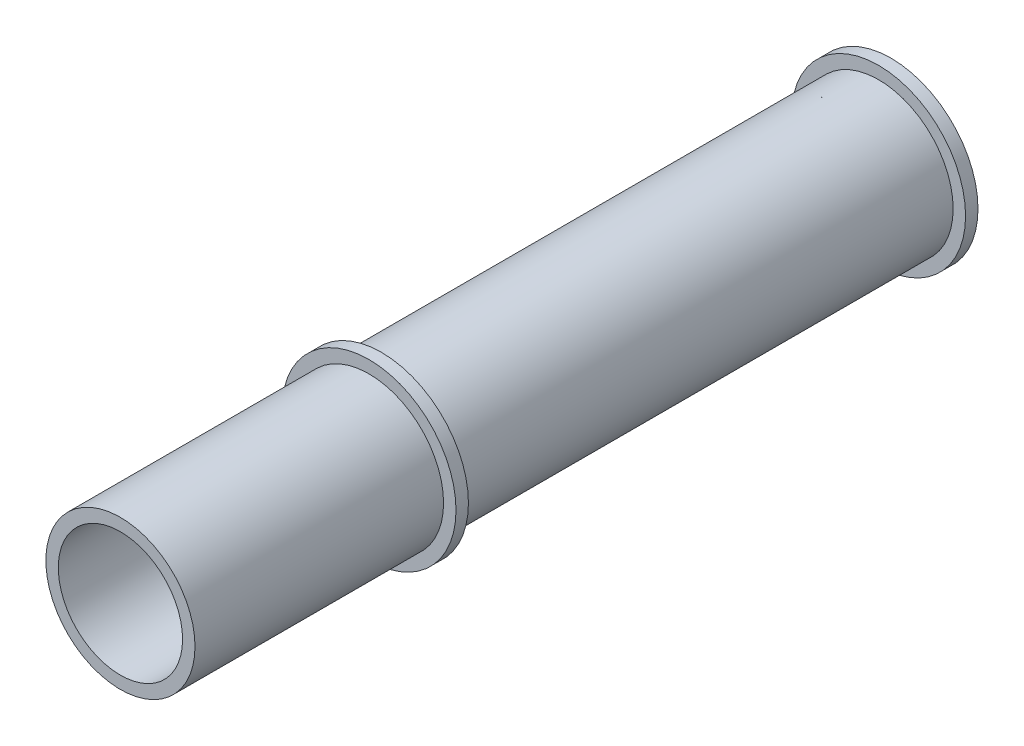
from build123d import *

# Parameters (mm, degrees)
SKETCH1_R           = 6
BOSS_EXTRUDE1_DEPTH = 40
SKETCH2_R           = 7
BOSS_EXTRUDE2_DEPTH = 1
BOSS_EXTRUDE3_START = 1
SKETCH3_R           = 7
BOSS_EXTRUDE3_DEPTH = 1
SKETCH4_R           = 6
BOSS_EXTRUDE4_DEPTH = 20
SKETCH5_R           = 5
CUT_EXTRUDE1_DEPTH  = 200


with BuildPart() as part:
    # Sketch1 → Boss-Extrude1 (new body)
    with BuildSketch(Plane.XY):
        Circle(SKETCH1_R)
    extrude(amount=BOSS_EXTRUDE1_DEPTH)

    # Sketch2 → Boss-Extrude2 (add)
    with BuildSketch(Plane(origin=(0, 0, 0), x_dir=(-1, 0, 0), z_dir=(0, 0, -1))):
        Circle(SKETCH2_R)
    extrude(amount=BOSS_EXTRUDE2_DEPTH)

    # Sketch3 → Boss-Extrude3 (add)
    with BuildSketch(Plane.XY.offset(40).offset(BOSS_EXTRUDE3_START)):
        with Locations(Location((0, 0, 0), (0, 0, 180))):
            Circle(SKETCH3_R)
    extrude(amount=-BOSS_EXTRUDE3_DEPTH)

    # Sketch4 → Boss-Extrude4 (add)
    with BuildSketch(Plane.XY.offset(41)):
        Circle(SKETCH4_R)
    extrude(amount=BOSS_EXTRUDE4_DEPTH)

    # Sketch5 → Cut-Extrude1 (cut)
    with BuildSketch(Plane.XY.offset(61)):
        Circle(SKETCH5_R)
    extrude(amount=-CUT_EXTRUDE1_DEPTH, mode=Mode.SUBTRACT)


solid = part.part
